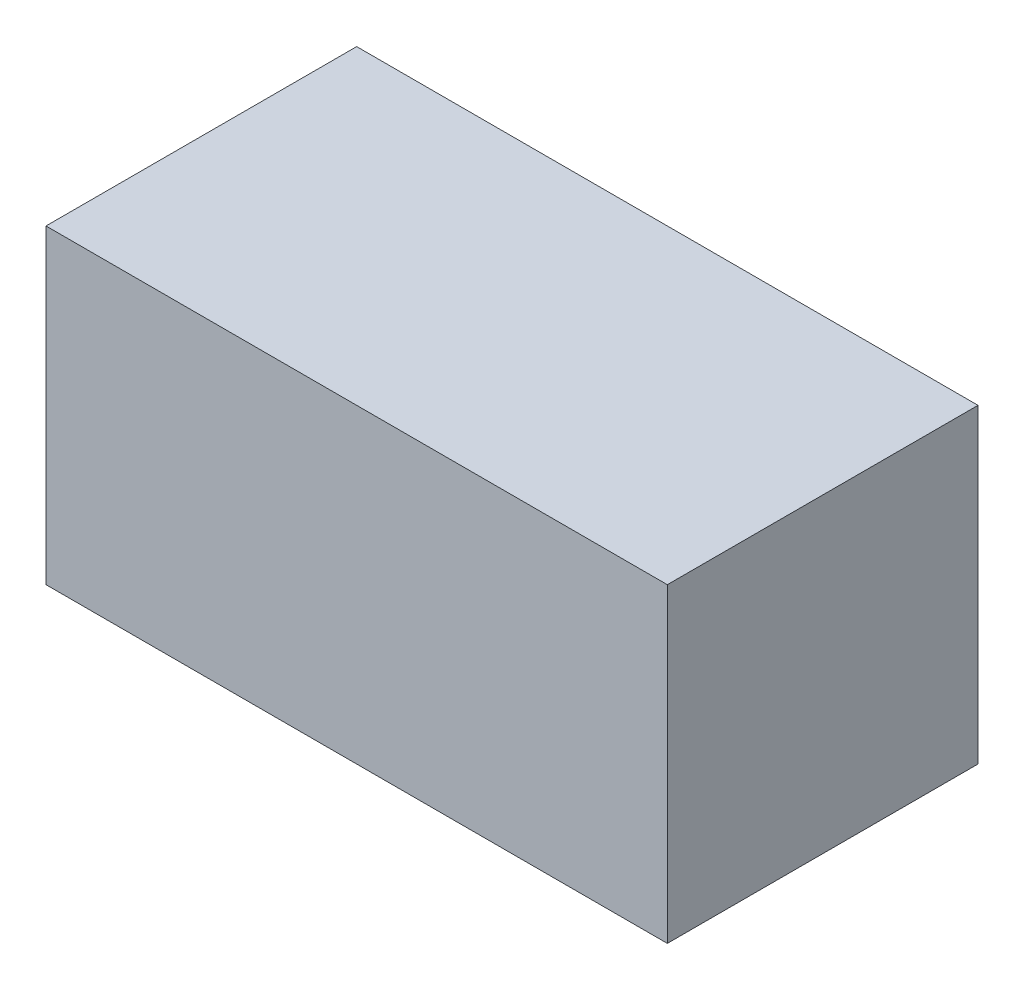
from build123d import *

# Parameters (mm, degrees)
SKETCH_1_W      = 4
SKETCH_1_H      = 4
EXTRUDE_1_DEPTH = 4


with BuildPart() as part:
    # 草图1 → 凸台-拉伸1 (new, symmetric)
    with BuildSketch(Plane(origin=(0, 0, 0), x_dir=(0, 0, -1), z_dir=(1, 0, 0))):
        Rectangle(SKETCH_1_W, SKETCH_1_H)
    extrude(amount=EXTRUDE_1_DEPTH, both=True)


solid = part.part
